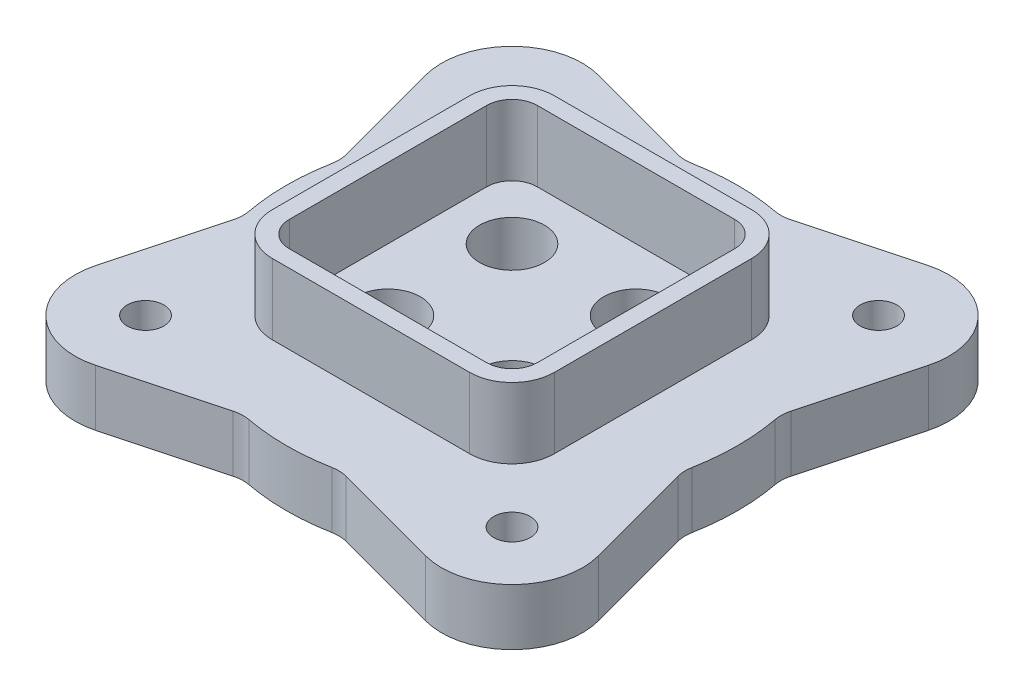
from build123d import *

# Parameters (mm, degrees)
SKETCH1_R           = 292.1
SKETCH1_R_2         = 165.1
BOSS_EXTRUDE1_DEPTH = 508
BOSS_EXTRUDE2_START = 508
BOSS_EXTRUDE2_DEPTH = 635
SKETCH2_R           = 1841.5
SKETCH2_R_2         = 1333.5
CUT_EXTRUDE1_DEPTH  = 76.2


with BuildPart() as part:
    # Sketch1 → Boss-Extrude1 (new body)
    with BuildSketch(Plane(origin=(0, 0, 0), x_dir=(1, 0, 0), z_dir=(0, 1, 0))):
        with BuildLine():
            Line((-509.129830316, 2002.437184733), (-1486.64990636, 2264.362899694))
            ThreePointArc((-1486.64990636, 2264.362899694), (-2100.012806053, 2100.012806053), (-2264.362899694, 1486.64990636))
            Line((-2264.362899694, 1486.64990636), (-2002.437184733, 509.129830316))
            ThreePointArc((-2002.437184733, 509.129830316), (-1992.275061974, 441.916911811), (-1997.262066596, 374.123291625))
            ThreePointArc((-1997.262066596, 374.123291625), (-2032, 0), (-1997.262066596, -374.123291625))
            ThreePointArc((-1997.262066596, -374.123291625), (-1992.275061974, -441.916911811), (-2002.437184733, -509.129830316))
            Line((-2002.437184733, -509.129830316), (-2264.362899694, -1486.64990636))
            ThreePointArc((-2264.362899694, -1486.64990636), (-2100.012806053, -2100.012806053), (-1486.64990636, -2264.362899694))
            Line((-1486.64990636, -2264.362899694), (-509.129830316, -2002.437184733))
            ThreePointArc((-509.129830316, -2002.437184733), (-441.916911811, -1992.275061974), (-374.123291625, -1997.262066596))
            ThreePointArc((-374.123291625, -1997.262066596), (0, -2032), (374.123291625, -1997.262066596))
            ThreePointArc((374.123291625, -1997.262066596), (441.916911811, -1992.275061974), (509.129830316, -2002.437184733))
            Line((509.129830316, -2002.437184733), (1486.64990636, -2264.362899694))
            ThreePointArc((1486.64990636, -2264.362899694), (2100.012806053, -2100.012806053), (2264.362899694, -1486.64990636))
            Line((2264.362899694, -1486.64990636), (2002.437184733, -509.129830316))
            ThreePointArc((2002.437184733, -509.129830316), (1992.275061974, -441.916911811), (1997.262066596, -374.123291625))
            ThreePointArc((1997.262066596, -374.123291625), (2032, 0), (1997.262066596, 374.123291625))
            ThreePointArc((1997.262066596, 374.123291625), (1992.275061974, 441.916911811), (2002.437184733, 509.129830316))
            Line((2002.437184733, 509.129830316), (2264.362899694, 1486.64990636))
            ThreePointArc((2264.362899694, 1486.64990636), (2100.012806053, 2100.012806053), (1486.64990636, 2264.362899694))
            Line((1486.64990636, 2264.362899694), (509.129830316, 2002.437184733))
            ThreePointArc((509.129830316, 2002.437184733), (441.916911811, 1992.275061974), (374.123291625, 1997.262066596))
            ThreePointArc((374.123291625, 1997.262066596), (0, 2032), (-374.123291625, 1997.262066596))
            ThreePointArc((-374.123291625, 1997.262066596), (-441.916911811, 1992.275061974), (-509.129830316, 2002.437184733))
        make_face()
        with Locations((-558.8, -558.8)):
            Circle(SKETCH1_R, mode=Mode.SUBTRACT)
        with Locations((558.8, -558.8)):
            Circle(SKETCH1_R, mode=Mode.SUBTRACT)
        with Locations((-558.8, 558.8)):
            Circle(SKETCH1_R, mode=Mode.SUBTRACT)
        with Locations((558.8, 558.8)):
            Circle(SKETCH1_R, mode=Mode.SUBTRACT)
        with Locations((-1651, -1651)):
            Circle(SKETCH1_R_2, mode=Mode.SUBTRACT)
        with Locations((1651, -1651)):
            Circle(SKETCH1_R_2, mode=Mode.SUBTRACT)
        with Locations((-1651, 1651)):
            Circle(SKETCH1_R_2, mode=Mode.SUBTRACT)
        with Locations((1651, 1651)):
            Circle(SKETCH1_R_2, mode=Mode.SUBTRACT)
    extrude(amount=BOSS_EXTRUDE1_DEPTH)

    # Sketch1<3> → Boss-Extrude2 (add)
    with BuildSketch(Plane(origin=(0, 0, 0), x_dir=(1, 0, 0), z_dir=(0, 1, 0)).offset(BOSS_EXTRUDE2_START)):
        with BuildLine():
            ThreePointArc((-1270, -889), (-1158.407683632, -1158.407683632), (-889, -1270))
            Line((-889, -1270), (889, -1270))
            ThreePointArc((889, -1270), (1158.407683632, -1158.407683632), (1270, -889))
            Line((1270, -889), (1270, 889))
            ThreePointArc((1270, 889), (1158.407683632, 1158.407683632), (889, 1270))
            Line((889, 1270), (-889, 1270))
            ThreePointArc((-889, 1270), (-1158.407683632, 1158.407683632), (-1270, 889))
            Line((-1270, 889), (-1270, -889))
        make_face()
        with BuildLine():
            ThreePointArc((-1117.6, 889), (-1050.644610179, 1050.644610179), (-889, 1117.6))
            Line((-889, 1117.6), (889, 1117.6))
            ThreePointArc((889, 1117.6), (1050.644610179, 1050.644610179), (1117.6, 889))
            Line((1117.6, 889), (1117.6, -889))
            ThreePointArc((1117.6, -889), (1050.644610179, -1050.644610179), (889, -1117.6))
            Line((889, -1117.6), (-889, -1117.6))
            ThreePointArc((-889, -1117.6), (-1050.644610179, -1050.644610179), (-1117.6, -889))
            Line((-1117.6, -889), (-1117.6, 889))
        make_face(mode=Mode.SUBTRACT)
    extrude(amount=BOSS_EXTRUDE2_DEPTH)

    # Sketch2 → Cut-Extrude1 (cut)
    with BuildSketch(Plane.XZ):
        Circle(SKETCH2_R)
        Circle(SKETCH2_R_2, mode=Mode.SUBTRACT)
    extrude(amount=-CUT_EXTRUDE1_DEPTH, mode=Mode.SUBTRACT)


solid = part.part
